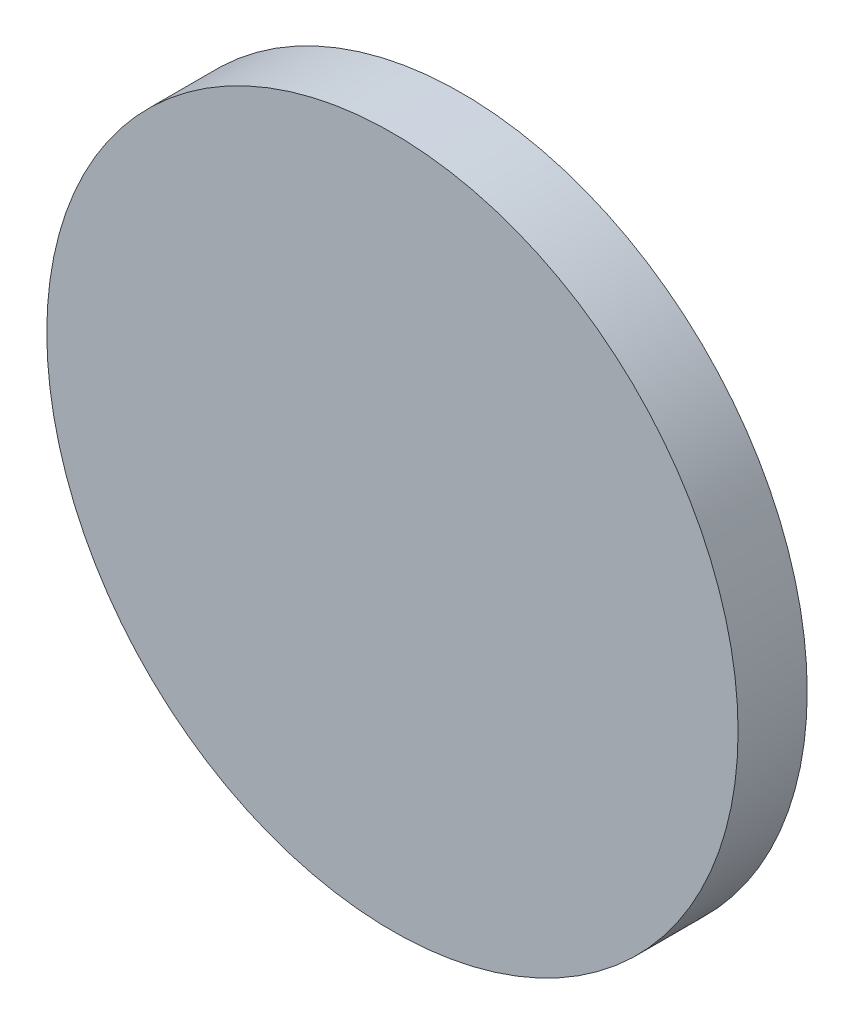
from build123d import *

# Parameters (mm, degrees)
ESQUISSE1_R        = 30
BOSS_EXTRU_1_DEPTH = 6


with BuildPart() as part:
    # Esquisse1 → Boss.-Extru.1 (new body)
    with BuildSketch(Plane.XY):
        Circle(ESQUISSE1_R)
    extrude(amount=BOSS_EXTRU_1_DEPTH)


solid = part.part
